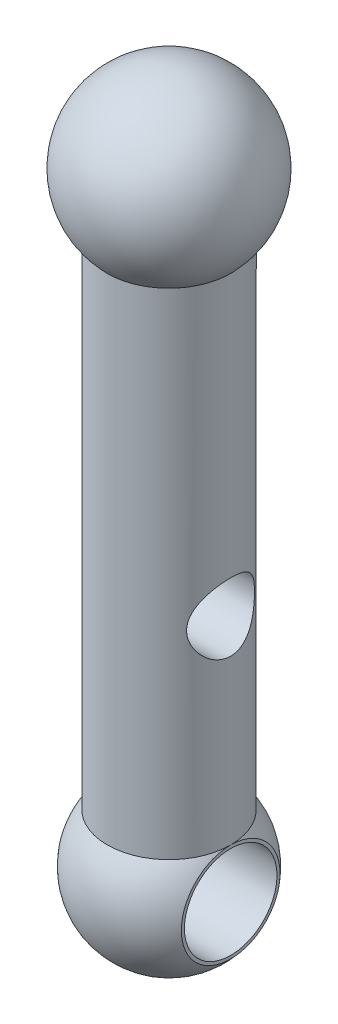
from build123d import *
from build123d.topology import SkipClean

# Parameters (mm, degrees)
SKETCH3_R           = 4.7625
CUT_EXTRUDE1_DEPTH  = 22.86
BOSS_EXTRUDE1_START = 5.08
SKETCH4_R           = 6.35
BOSS_EXTRUDE1_DEPTH = 57.15
SKETCH6_R           = 3.4925
CUT_EXTRUDE2_DEPTH  = 75.063978424


with BuildPart() as part:
    # Sketch1 → Revolve1 (revolve)
    with BuildSketch(Plane(origin=(0, 0, 0), x_dir=(1, 0, 0), z_dir=(0, 1, 0))):
        with BuildLine():
            Line((0, 0), (0, -5.08))
            Line((0, -5.08), (12.7, -5.08))
            Line((12.7, -5.08), (12.7, 0))
            ThreePointArc((12.7, 0), (6.35, 3.051967782), (0, 0))
        make_face()
    revolve(axis=Axis((0, 0, 5.08), (1, 0, 0)))

    # Sketch3 → Cut-Extrude1 (cut)
    with BuildSketch(Plane.ZY):
        with Locations((5.08, 0)):
            Circle(SKETCH3_R)
    extrude(amount=-CUT_EXTRUDE1_DEPTH, mode=Mode.SUBTRACT)

    # Sketch4 → Boss-Extrude1 (add)
    with SkipClean():  # the faces are left unmerged after this step: merging them gives an invalid solid
        with BuildSketch(Plane(origin=(0, 0, 0), x_dir=(1, 0, 0), z_dir=(0, 1, 0)).offset(BOSS_EXTRUDE1_START)):
            with Locations((6.35, -5.08)):
                Circle(SKETCH4_R)
        extrude(amount=BOSS_EXTRUDE1_DEPTH)

    # Sketch5 → Revolve2 (revolve)
    with SkipClean():  # the faces are left unmerged after this step: merging them gives an invalid solid
        with BuildSketch(Plane(origin=(0, 62.23, 0), x_dir=(1, 0, 0), z_dir=(0, 1, 0))):
            with BuildLine():
                Line((6.35, 3.81), (6.35, -13.97))
                ThreePointArc((6.35, -13.97), (15.24, -5.08), (6.35, 3.81))
            make_face()
        revolve(axis=Axis((6.35, 62.23, -3.81), (0, 0, 1)))

    # Sketch6 → Cut-Extrude2 (cut, through all)
    with SkipClean():  # the faces are left unmerged after this step: merging them gives an invalid solid
        with BuildSketch(Plane(origin=(0, 0, 0), x_dir=(0, 0, -1), z_dir=(1, 0, 0))):
            with Locations((-5.08, 25.4)):
                Circle(SKETCH6_R)
        extrude(amount=CUT_EXTRUDE2_DEPTH, mode=Mode.SUBTRACT)


solid = part.part
